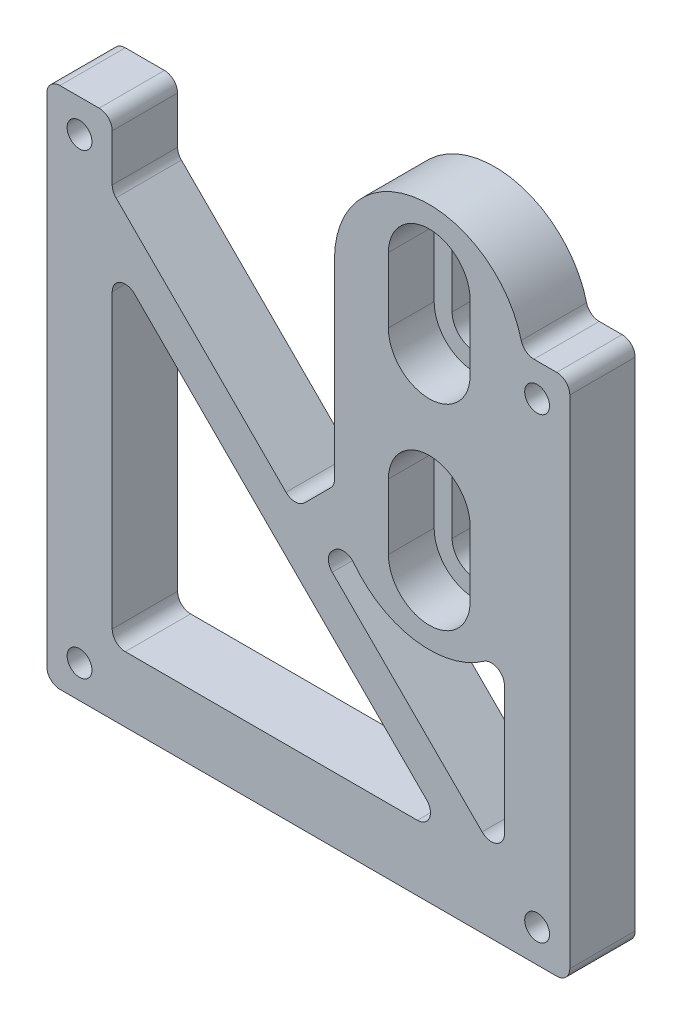
from build123d import *

# Parameters (mm, degrees)
SKETCH1_R           = 0.95
SKETCH1_R_2         = 1.75
BOSS_EXTRUDE1_DEPTH = 5
SKETCH6_R           = 3.125
CUT_EXTRUDE1_DEPTH  = 3.2
CUT_EXTRUDE2_DEPTH  = 62.351955959
CUT_EXTRUDE3_DEPTH  = 3.5
FILLET1_R           = 1


with BuildPart() as part:
    # Sketch1 → Boss-Extrude1 (new body)
    with BuildSketch(Plane.XY):
        with BuildLine():
            Line((0, 40), (0, 0))
            Line((0, 0), (40, 0))
            Line((40, 0), (40, 40))
            Line((40, 40), (36.430703308, 40))
            ThreePointArc((36.430703308, 40), (28.74880093, 46.232655079), (22, 39))
            Line((22, 39), (22, 24))
            Line((22, 24), (19, 21))
            Line((19, 21), (5, 35))
            Line((5, 35), (5, 40))
            Line((5, 40), (0, 40))
        make_face()
        Polygon((5, 5), (5, 30.757359313), (30.757359313, 5), align=None, mode=Mode.SUBTRACT)
        with BuildLine():
            Line((35, 19.584119567), (35, 5))
            Line((35, 5), (21.121320344, 18.878679656))
            Line((21.121320344, 18.878679656), (22.845279894, 20.602639207))
            ThreePointArc((22.845279894, 20.602639207), (28.644599167, 16.77532078), (35, 19.584119567))
        make_face(mode=Mode.SUBTRACT)
        with Locations((2.5, 2.5)):
            Circle(SKETCH1_R, mode=Mode.SUBTRACT)
        with Locations((37.5, 2.5)):
            Circle(SKETCH1_R, mode=Mode.SUBTRACT)
        with Locations((2.5, 37.5)):
            Circle(SKETCH1_R, mode=Mode.SUBTRACT)
        with Locations((37.5, 37.5)):
            Circle(SKETCH1_R, mode=Mode.SUBTRACT)
        with Locations((29.25, 39)):
            Circle(SKETCH1_R_2, mode=Mode.SUBTRACT)
        with Locations((29.25, 24)):
            Circle(SKETCH1_R_2, mode=Mode.SUBTRACT)
    extrude(amount=BOSS_EXTRUDE1_DEPTH)

    # Sketch6 → Cut-Extrude1 (cut)
    with BuildSketch(Plane.XY.offset(5)):
        with Locations((29.25, 39)):
            Circle(SKETCH6_R)
        with Locations((29.25, 24)):
            Circle(SKETCH6_R)
    extrude(amount=-CUT_EXTRUDE1_DEPTH, mode=Mode.SUBTRACT)

    # Sketch7 → Cut-Extrude2 (cut, through all)
    with BuildSketch(Plane.XY.offset(5)):
        with BuildLine():
            Line((27.5, 26.5), (27.5, 21.5))
            ThreePointArc((27.5, 21.5), (29.25, 19.75), (31, 21.5))
            Line((31, 21.5), (31, 26.5))
            ThreePointArc((31, 26.5), (29.25, 28.25), (27.5, 26.5))
        make_face()
        with BuildLine():
            Line((27.5, 41.5), (27.5, 36.5))
            ThreePointArc((27.5, 36.5), (29.25, 34.75), (31, 36.5))
            Line((31, 36.5), (31, 41.5))
            ThreePointArc((31, 41.5), (29.25, 43.25), (27.5, 41.5))
        make_face()
    extrude(amount=-CUT_EXTRUDE2_DEPTH, mode=Mode.SUBTRACT)

    # Sketch7<3> → Cut-Extrude3 (cut)
    # profile 1 of 2: a face of its own
    with BuildSketch(Plane.XY.offset(5)):
        with BuildLine():
            Line((32.375, 26.5), (32.375, 21.5))
            ThreePointArc((32.375, 21.5), (29.25, 18.375), (26.125, 21.5))
            Line((26.125, 21.5), (26.125, 26.5))
            ThreePointArc((26.125, 26.5), (29.25, 29.625), (32.375, 26.5))
        make_face()
        with BuildLine():
            Line((31, 26.5), (31, 21.5))
            ThreePointArc((31, 21.5), (29.25, 19.75), (27.5, 21.5))
            Line((27.5, 21.5), (27.5, 26.5))
            ThreePointArc((27.5, 26.5), (29.25, 28.25), (31, 26.5))
        make_face(mode=Mode.SUBTRACT)
    # profile 2 of 2: a face of its own
    with BuildSketch(Plane.XY.offset(5)):
        with BuildLine():
            Line((32.375, 41.5), (32.375, 36.5))
            ThreePointArc((32.375, 36.5), (29.25, 33.375), (26.125, 36.5))
            Line((26.125, 36.5), (26.125, 41.5))
            ThreePointArc((26.125, 41.5), (29.25, 44.625), (32.375, 41.5))
        make_face()
        with BuildLine():
            Line((31, 41.5), (31, 36.5))
            ThreePointArc((31, 36.5), (29.25, 34.75), (27.5, 36.5))
            Line((27.5, 36.5), (27.5, 41.5))
            ThreePointArc((27.5, 41.5), (29.25, 43.25), (31, 41.5))
        make_face(mode=Mode.SUBTRACT)
    extrude(amount=-CUT_EXTRUDE3_DEPTH, mode=Mode.SUBTRACT)

    # Fillet1
    fillet1_edges = [part.edges().sort_by_distance(p)[0] for p in [
        (5, 30.757359313, 2.5),
        (40, 40, 2.5),
        (36.430703308, 40, 2.5),
        (35, 19.584119567, 2.5),
        (22.845279894, 20.602639207, 2.5),
        (21.121320344, 18.878679656, 2.5),
        (22, 24, 2.5),
        (19, 21, 2.5),
        (30.757359313, 5, 2.5),
        (35, 5, 2.5),
        (5, 5, 2.5),
        (5, 35, 2.5),
        (5, 40, 2.5),
        (0, 40, 2.5),
        (40, 0, 2.5),
        (0, 0, 2.5),
    ]]
    fillet(fillet1_edges, radius=FILLET1_R)


solid = part.part
